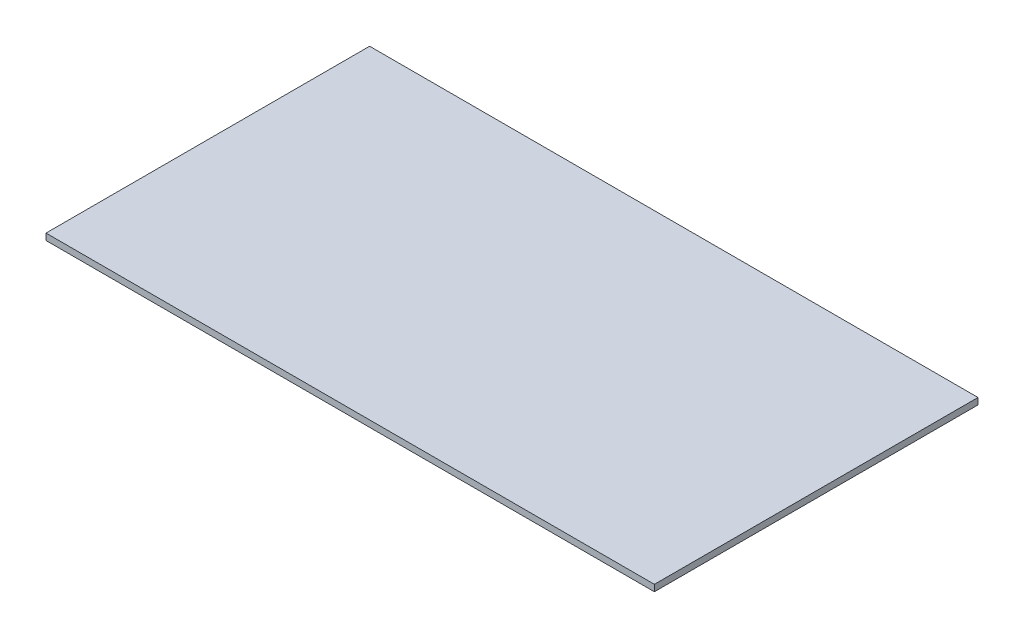
from build123d import *

# Parameters (mm, degrees)
SKETCH1_W           = 4700
SKETCH1_H           = 2500
BOSS_EXTRUDE1_DEPTH = 50


with BuildPart() as part:
    # Sketch1 → Boss-Extrude1 (new body)
    with BuildSketch(Plane(origin=(0, 0, 0), x_dir=(1, 0, 0), z_dir=(0, 1, 0))):
        with Locations((2350, 1250)):
            Rectangle(SKETCH1_W, SKETCH1_H)
    extrude(amount=BOSS_EXTRUDE1_DEPTH)


solid = part.part
